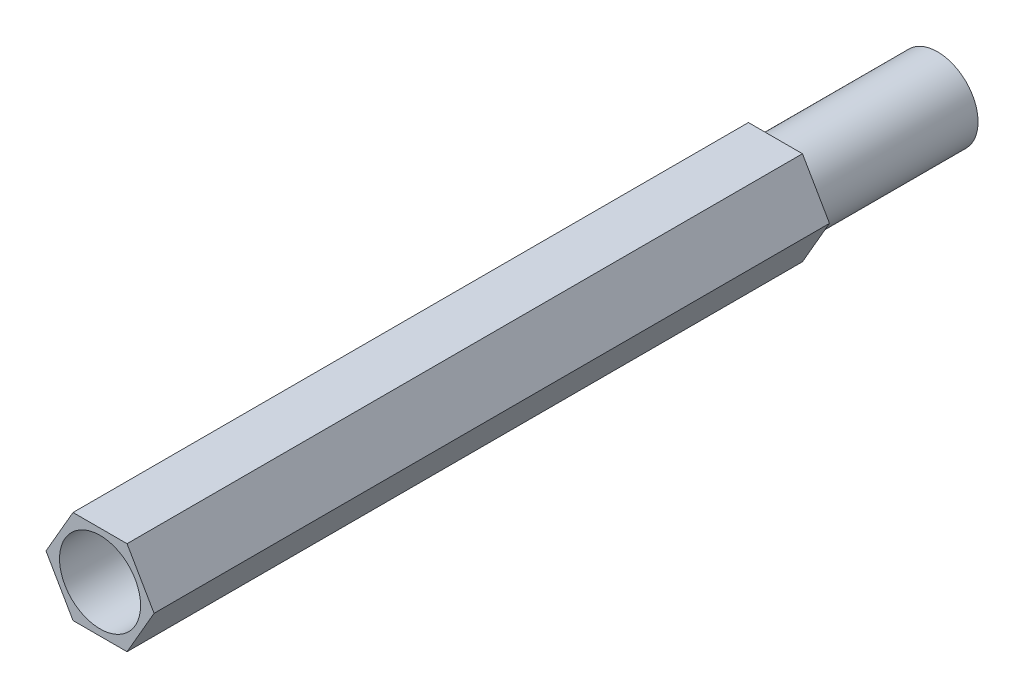
from build123d import *

# Parameters (mm, degrees)
EXTRUDE_1_DEPTH           = 25
SKETCH_2_W                = 1.5
SKETCH_2_H                = 6
HOLE_WIZARD_3_0_3_1_D     = 3
HOLE_WIZARD_3_0_3_1_DEPTH = 5


with BuildPart() as part:
    # 草图1 → 凸台-拉伸1 (new body)
    with BuildSketch(Plane(origin=(0, 0, 0), x_dir=(-1, 0, 0), z_dir=(0, 0, -1))):
        Polygon((1, -1.732050808), (2, 0), (1, 1.732050808), (-1, 1.732050808), (-2, 0), (-1, -1.732050808), align=None)
    extrude(amount=-EXTRUDE_1_DEPTH)

    # 草图2 → 旋转1 (revolve)
    with BuildSketch(Plane.XZ, mode=Mode.PRIVATE) as revolve_1_sk:
        with Locations((0.75, -3)):
            Rectangle(SKETCH_2_W, SKETCH_2_H)
    revolve(revolve_1_sk.sketch.rotate(Axis((0, 0, 0), (0, 0, -1)), 180), axis=Axis((0, 0, 0), (0, 0, -1)))

    # Ø3.0 (3) 直径孔1
    with Locations(Plane.XY.offset(25)):
        with Locations((0, 0)):
            Hole(HOLE_WIZARD_3_0_3_1_D / 2, depth=HOLE_WIZARD_3_0_3_1_DEPTH)


solid = part.part
